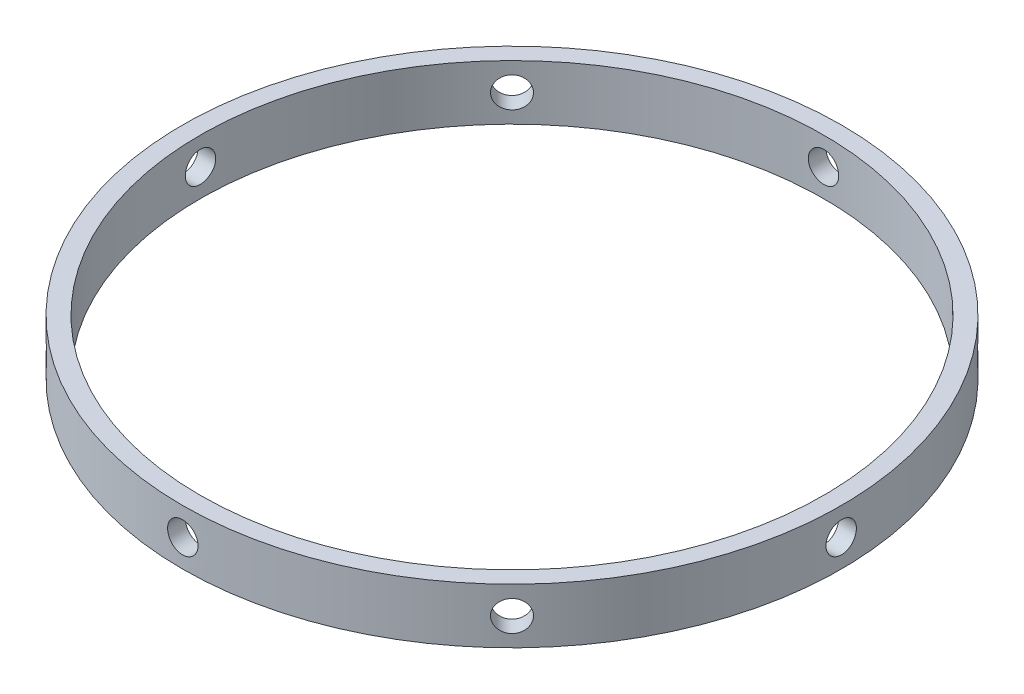
from build123d import *

# Parameters (mm, degrees)
SKETCH2_R           = 37.973
SKETCH2_R_2         = 35.941
BOSS_EXTRUDE1_DEPTH = 6.35
SKETCH3_R           = 1.7526
CUT_EXTRUDE1_DEPTH  = 200.35
CIRPATTERN1_COUNT   = 8


with BuildPart() as part:
    # Sketch2 → Boss-Extrude1 (new body)
    with BuildSketch(Plane(origin=(0, 0, 0), x_dir=(1, 0, 0), z_dir=(0, 1, 0))):
        with Locations(Location((-232.087586101, -128.629490495, 0), (0, 0, 270))):
            Circle(SKETCH2_R)
        with Locations(Location((-232.087586101, -128.629490495, 0), (0, 0, 270))):
            Circle(SKETCH2_R_2, mode=Mode.SUBTRACT)
    extrude(amount=BOSS_EXTRUDE1_DEPTH)

    # Sketch3 → Cut-Extrude1 (cut)
    with BuildSketch(Plane(origin=(0, 0, 0), x_dir=(0, 0, -1), z_dir=(1, 0, 0))):
        with Locations((-128.629490495, 3.175)):
            Circle(SKETCH3_R)
    cut_extrude1 = extrude(amount=-CUT_EXTRUDE1_DEPTH, mode=Mode.SUBTRACT)

    # CirPattern1: Cut-Extrude1 ×8 about axis
    cirpattern1_axis = Axis((-232.087586101, 0, 128.629490495), (0, -1, 0))
    for i in range(1, CIRPATTERN1_COUNT):
        add(cut_extrude1.rotate(cirpattern1_axis, i * 360 / CIRPATTERN1_COUNT), mode=Mode.SUBTRACT)


solid = part.part
